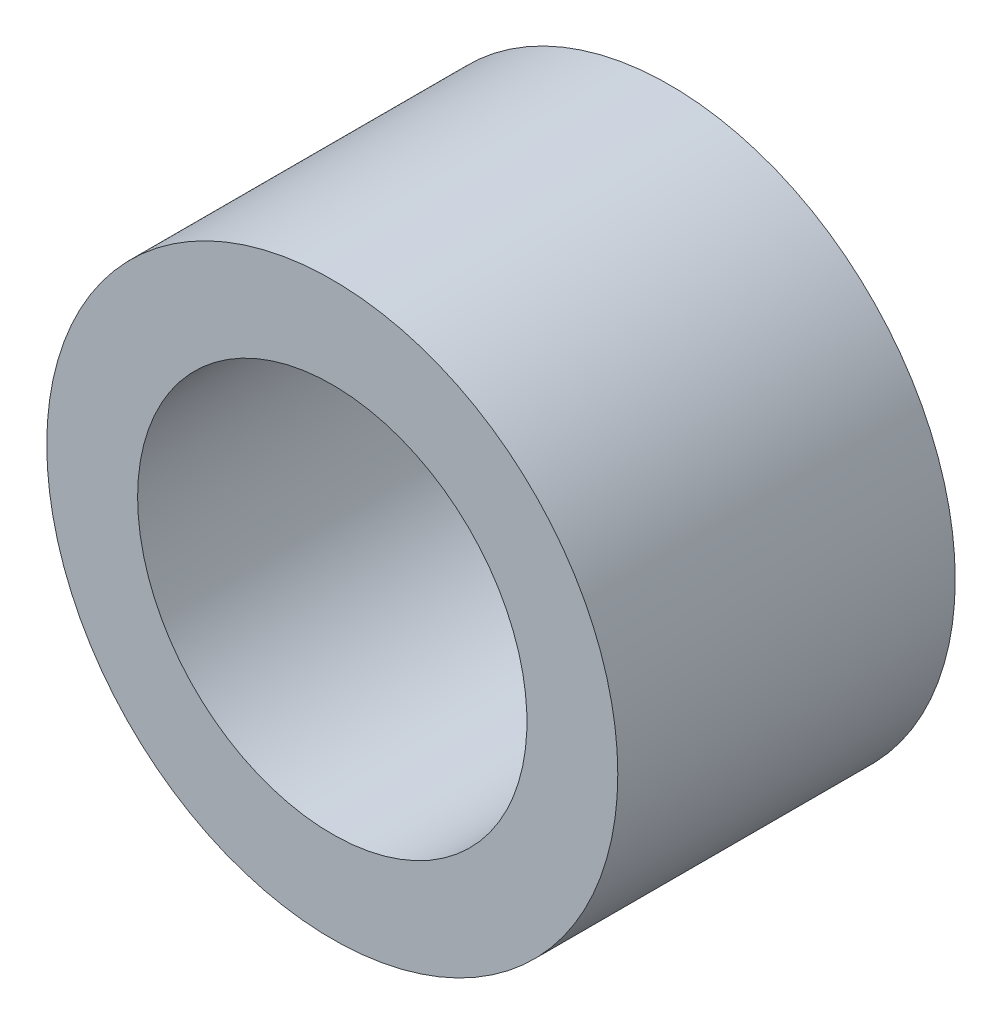
from build123d import *

# Parameters (mm, degrees)
SKETCH_1_R      = 11
SKETCH_1_R_2    = 7.5
EXTRUDE_1_DEPTH = 13


with BuildPart() as part:
    # 草图1 → 凸台-拉伸1 (new body)
    with BuildSketch(Plane.XY):
        with Locations(Location((0, 0, 0), (0, 0, 180))):
            Circle(SKETCH_1_R)
        with Locations(Location((0, 0, 0), (0, 0, 180))):
            Circle(SKETCH_1_R_2, mode=Mode.SUBTRACT)
    extrude(amount=EXTRUDE_1_DEPTH)


solid = part.part
